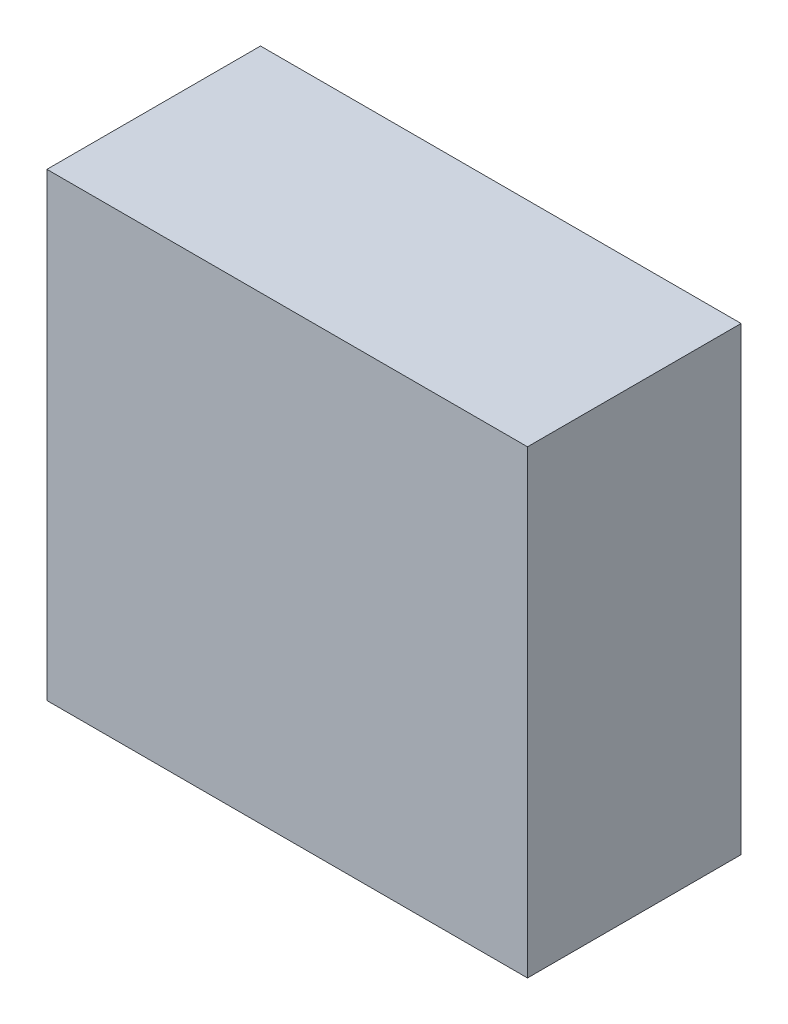
from build123d import *

# Parameters (mm, degrees)
SKETCH_1_W      = 117
SKETCH_1_H      = 112
EXTRUDE_1_DEPTH = 52


with BuildPart() as part:
    # 草图1 → 凸台-拉伸1 (new body)
    with BuildSketch(Plane.XY):
        Rectangle(SKETCH_1_W, SKETCH_1_H)
    extrude(amount=EXTRUDE_1_DEPTH)


solid = part.part
